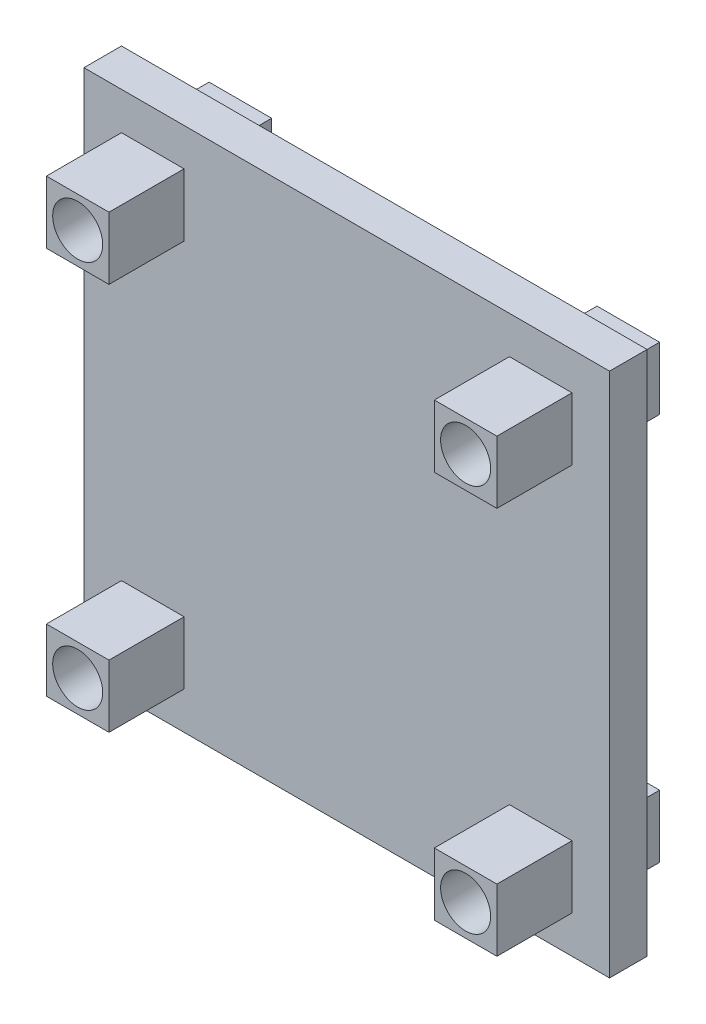
from build123d import *

# Parameters (mm, degrees)
SKETCH2_W               = 42
SKETCH2_H               = 42
BOSS_EXTRUDE1_DEPTH     = 3
BOSS_EXTRUDE9_START     = 3
SKETCH2_5_W             = 5
SKETCH2_5_H             = 5
BOSS_EXTRUDE9_DEPTH     = 6
CUT_EXTRUDE3_DEPTH      = 32.032241298
CUT_EXTRUDE3_DEPTH_BACK = 32.032241298
SKETCH2_7_R             = 2
BOSS_EXTRUDE10_START    = -4
SKETCH2_6_W             = 5
SKETCH2_6_H             = 5
SKETCH2_6_R             = 2
BOSS_EXTRUDE10_DEPTH    = 4


with BuildPart() as part:
    # Sketch2 → Boss-Extrude1 (new body)
    with BuildSketch(Plane.XY):
        Rectangle(SKETCH2_W, SKETCH2_H)
    extrude(amount=BOSS_EXTRUDE1_DEPTH)

    # Sketch2<5> → Boss-Extrude9 (add)
    with BuildSketch(Plane.XY.offset(BOSS_EXTRUDE9_START)):
        with Locations((-15.5, 15.5)):
            Rectangle(SKETCH2_5_W, SKETCH2_5_H)
        with Locations((15.5, 15.5)):
            Rectangle(SKETCH2_5_W, SKETCH2_5_H)
        with Locations((15.5, -15.5)):
            Rectangle(SKETCH2_5_W, SKETCH2_5_H)
        with Locations((-15.5, -15.5)):
            Rectangle(SKETCH2_5_W, SKETCH2_5_H)
    extrude(amount=BOSS_EXTRUDE9_DEPTH)

    # Sketch2<7> → Cut-Extrude3 (cut, two sides: drawn at the far end of the back side and taken through both)
    with BuildSketch(Plane.XY.offset(-CUT_EXTRUDE3_DEPTH_BACK)):
        with Locations(Location((-15.5, 15.5, 0), (0, 0, 180))):
            Circle(SKETCH2_7_R)
        with Locations(Location((15.5, 15.5, 0), (0, 0, 180))):
            Circle(SKETCH2_7_R)
        with Locations(Location((15.5, -15.5, 0), (0, 0, 180))):
            Circle(SKETCH2_7_R)
        with Locations(Location((-15.5, -15.5, 0), (0, 0, 180))):
            Circle(SKETCH2_7_R)
    extrude(amount=CUT_EXTRUDE3_DEPTH + CUT_EXTRUDE3_DEPTH_BACK, mode=Mode.SUBTRACT)

    # Sketch2<6> → Boss-Extrude10 (add)
    # profile 1 of 4: a face of its own
    with BuildSketch(Plane.XY.offset(BOSS_EXTRUDE10_START)):
        with Locations((-15.5, -15.5)):
            Rectangle(SKETCH2_6_W, SKETCH2_6_H)
        with Locations(Location((-15.5, -15.5, 0), (0, 0, 180))):
            Circle(SKETCH2_6_R, mode=Mode.SUBTRACT)
    # profile 2 of 4: a face of its own
    with BuildSketch(Plane.XY.offset(BOSS_EXTRUDE10_START)):
        with Locations((15.5, -15.5)):
            Rectangle(SKETCH2_6_W, SKETCH2_6_H)
        with Locations(Location((15.5, -15.5, 0), (0, 0, 180))):
            Circle(SKETCH2_6_R, mode=Mode.SUBTRACT)
    # profile 3 of 4: a face of its own
    with BuildSketch(Plane.XY.offset(BOSS_EXTRUDE10_START)):
        with Locations((15.5, 15.5)):
            Rectangle(SKETCH2_6_W, SKETCH2_6_H)
        with Locations(Location((15.5, 15.5, 0), (0, 0, 180))):
            Circle(SKETCH2_6_R, mode=Mode.SUBTRACT)
    # profile 4 of 4: a face of its own
    with BuildSketch(Plane.XY.offset(BOSS_EXTRUDE10_START)):
        with Locations((-15.5, 15.5)):
            Rectangle(SKETCH2_6_W, SKETCH2_6_H)
        with Locations(Location((-15.5, 15.5, 0), (0, 0, 180))):
            Circle(SKETCH2_6_R, mode=Mode.SUBTRACT)
    extrude(amount=BOSS_EXTRUDE10_DEPTH)


solid = part.part
